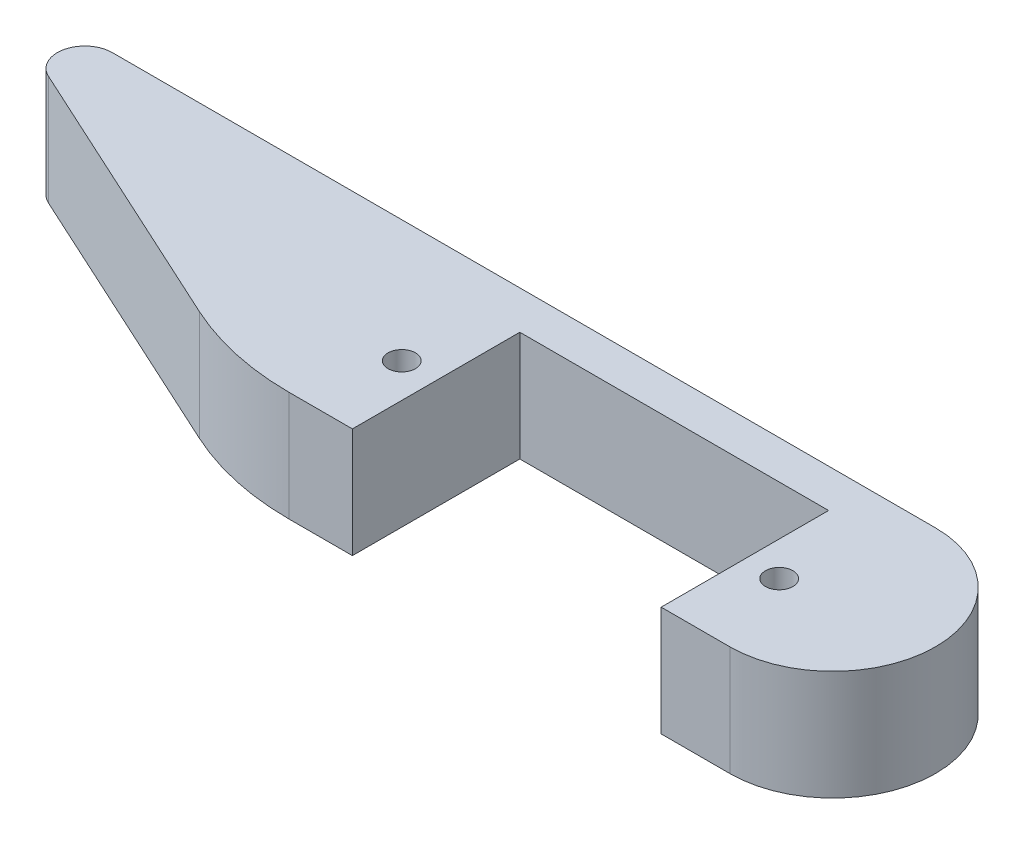
from build123d import *

# Parameters (mm, degrees)
SKETCH_1_R      = 1
EXTRUDE_1_DEPTH = 8


with BuildPart() as part:
    # 草圖1 → 填料-伸長1 (new body)
    with BuildSketch(Plane(origin=(0, 0, 0), x_dir=(1, 0, 0), z_dir=(0, 1, 0))):
        with BuildLine():
            Line((0, 0), (0, 12.2))
            Line((0, 12.2), (-22.5, 12.2))
            Line((-22.5, 12.2), (-22.5, 0))
            Line((-22.5, 0), (-27.124303732, 0))
            ThreePointArc((-27.124303732, 0), (-31.398520886, 0.462060812), (-35.475243216, 1.826893228))
            Line((-35.475243216, 1.826893228), (-55.835093948, 11.182689323))
            ThreePointArc((-55.835093948, 11.182689323), (-56.953793919, 13.427421715), (-55, 15))
            Line((-55, 15), (5, 15))
            ThreePointArc((5, 15), (12.5, 7.5), (5, 0))
            Line((5, 0), (0, 0))
        make_face()
        with Locations(Location((-25, 6.1, 0), (0, 0, 270))):
            Circle(SKETCH_1_R, mode=Mode.SUBTRACT)
        with Locations(Location((2.5, 6.1, 0), (0, 0, 270))):
            Circle(SKETCH_1_R, mode=Mode.SUBTRACT)
    extrude(amount=EXTRUDE_1_DEPTH)


solid = part.part
